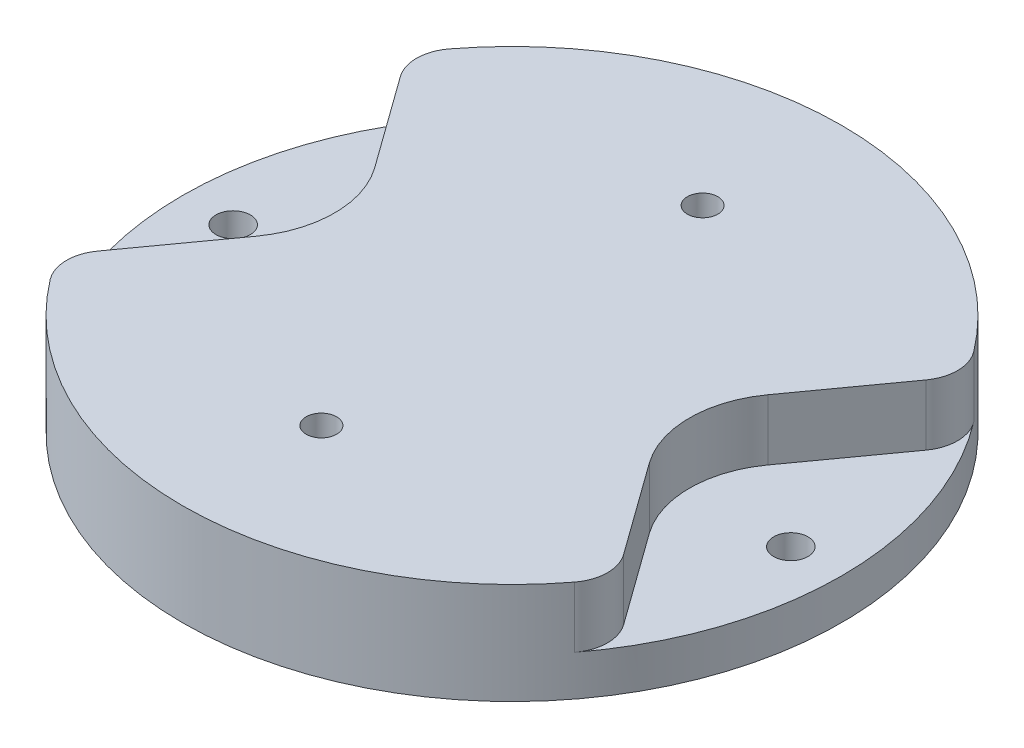
from build123d import *

# Parameters (mm, degrees)
SKETCH1_R           = 41.275
BOSS_EXTRUDE1_DEPTH = 12.7
SKETCH1_4_R         = 2.15
SKETCH1_4_R_2       = 1.905
CUT_EXTRUDE2_DEPTH  = 60.737268518
SKETCH1_5_R         = 7.62
SKETCH1_5_R_2       = 1.905
CUT_EXTRUDE3_DEPTH  = 5.08
CUT_EXTRUDE4_START  = 5.08
SKETCH1_6_R         = 2.15
CUT_EXTRUDE4_DEPTH  = 7.62
FILLET1_R           = 5.08


with BuildPart() as part:
    # Sketch1 → Boss-Extrude1 (new body)
    with BuildSketch(Plane(origin=(0, 0, 0), x_dir=(1, 0, 0), z_dir=(0, 1, 0))):
        with Locations(Location((0, 0, 0), (0, 0, 270))):
            Circle(SKETCH1_R)
    extrude(amount=BOSS_EXTRUDE1_DEPTH)

    # Sketch1<4> → Cut-Extrude2 (cut, through all)
    with BuildSketch(Plane(origin=(0, 0, 0), x_dir=(1, 0, 0), z_dir=(0, 1, 0))):
        with Locations(Location((-34.925, 0, 0), (0, 0, 270))):
            Circle(SKETCH1_4_R)
        with Locations(Location((34.925, 0, 0), (0, 0, 270))):
            Circle(SKETCH1_4_R)
        with Locations(Location((0, 23.876, 0), (0, 0, 270))):
            Circle(SKETCH1_4_R_2)
        with Locations(Location((0, -23.876, 0), (0, 0, 270))):
            Circle(SKETCH1_4_R_2)
    extrude(amount=CUT_EXTRUDE2_DEPTH, mode=Mode.SUBTRACT)

    # Sketch1<5> → Cut-Extrude3 (cut)
    # profile 1 of 2: a face of its own
    with BuildSketch(Plane(origin=(0, 0, 0), x_dir=(1, 0, 0), z_dir=(0, 1, 0))):
        with Locations(Location((0, -23.876, 0), (0, 0, 270))):
            Circle(SKETCH1_5_R)
        with Locations(Location((0, -23.876, 0), (0, 0, 270))):
            Circle(SKETCH1_5_R_2, mode=Mode.SUBTRACT)
    # profile 2 of 2: a face of its own
    with BuildSketch(Plane(origin=(0, 0, 0), x_dir=(1, 0, 0), z_dir=(0, 1, 0))):
        with Locations(Location((0, 23.876, 0), (0, 0, 270))):
            Circle(SKETCH1_5_R)
        with Locations(Location((0, 23.876, 0), (0, 0, 270))):
            Circle(SKETCH1_5_R_2, mode=Mode.SUBTRACT)
    extrude(amount=CUT_EXTRUDE3_DEPTH, mode=Mode.SUBTRACT)

    # Sketch1<6> → Cut-Extrude4 (cut)
    # profile 1 of 2: a face of its own
    with BuildSketch(Plane(origin=(0, 0, 0), x_dir=(1, 0, 0), z_dir=(0, 1, 0)).offset(CUT_EXTRUDE4_START)):
        with BuildLine():
            ThreePointArc((-35.017363636, 21.849710958), (-41.275, 0), (-35.017363636, -21.849710958))
            Line((-35.017363636, -21.849710958), (-24.621881181, -7.425344611))
            ThreePointArc((-24.621881181, -7.425344611), (-22.225, 0), (-24.621881181, 7.425344611))
            Line((-24.621881181, 7.425344611), (-35.017363636, 21.849710958))
        make_face()
        with Locations(Location((-34.925, 0, 0), (0, 0, 270))):
            Circle(SKETCH1_6_R, mode=Mode.SUBTRACT)
    # profile 2 of 2: a face of its own
    with BuildSketch(Plane(origin=(0, 0, 0), x_dir=(1, 0, 0), z_dir=(0, 1, 0)).offset(CUT_EXTRUDE4_START)):
        with BuildLine():
            Line((35.017363636, 21.849710958), (24.621881181, 7.425344611))
            ThreePointArc((24.621881181, 7.425344611), (22.225, 0), (24.621881181, -7.425344611))
            Line((24.621881181, -7.425344611), (35.017363636, -21.849710958))
            ThreePointArc((35.017363636, -21.849710958), (41.275, 0), (35.017363636, 21.849710958))
        make_face()
        with Locations(Location((34.925, 0, 0), (0, 0, 270))):
            Circle(SKETCH1_6_R, mode=Mode.SUBTRACT)
    extrude(amount=CUT_EXTRUDE4_DEPTH, mode=Mode.SUBTRACT)

    # Fillet1
    fillet1_edges = [part.edges().sort_by_distance(p)[0] for p in [
        (35.017363636, 8.89, -21.849710958),
        (35.017363636, 8.89, 21.849710958),
        (-35.017363636, 8.89, 21.849710958),
        (-35.017363636, 8.89, -21.849710958),
    ]]
    fillet(fillet1_edges, radius=FILLET1_R)


solid = part.part
